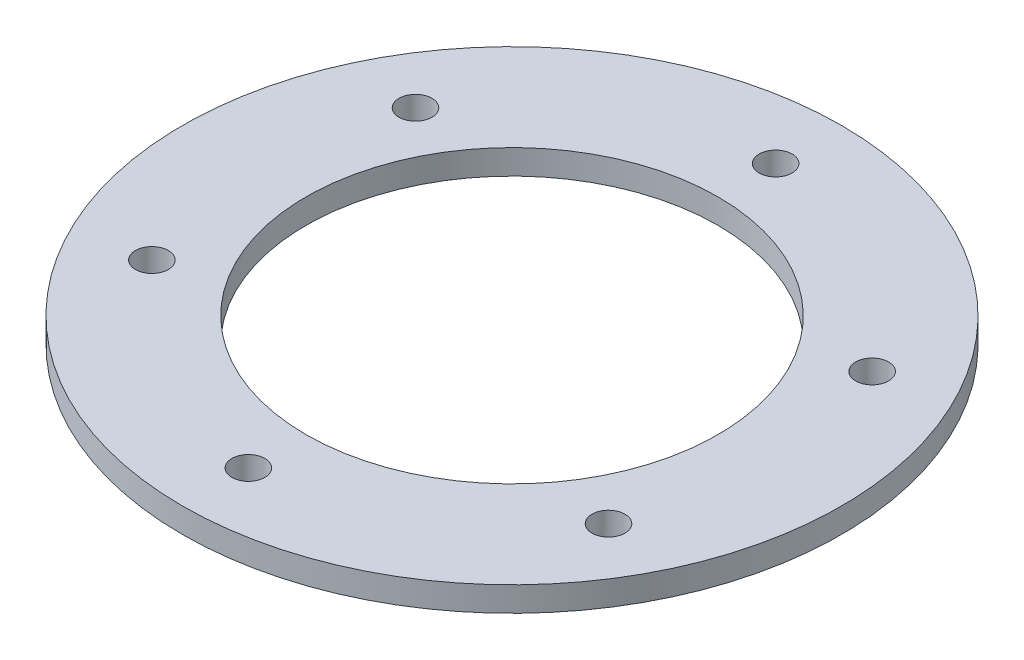
from build123d import *

# Parameters (mm, degrees)
SKETCH_2_R      = 200
SKETCH_2_R_2    = 125
SKETCH_2_R_3    = 10
EXTRUDE_1_DEPTH = 15


with BuildPart() as part:
    # 草圖2 → 填料-伸長1 (new body)
    with BuildSketch(Plane(origin=(0, 0, 0), x_dir=(1, 0, 0), z_dir=(0, 1, 0))):
        with Locations(Location((0, 0, 0), (0, 0, 270))):
            Circle(SKETCH_2_R)
        with Locations(Location((0, 0, 0), (0, 0, 270))):
            Circle(SKETCH_2_R_2, mode=Mode.SUBTRACT)
        with Locations(Location((0, 160, 0), (0, 0, 270))):
            Circle(SKETCH_2_R_3, mode=Mode.SUBTRACT)
        with Locations(Location((138.564064606, 80, 0), (0, 0, 270))):
            Circle(SKETCH_2_R_3, mode=Mode.SUBTRACT)
        with Locations(Location((138.564064606, -80, 0), (0, 0, 270))):
            Circle(SKETCH_2_R_3, mode=Mode.SUBTRACT)
        with Locations(Location((0, -160, 0), (0, 0, 270))):
            Circle(SKETCH_2_R_3, mode=Mode.SUBTRACT)
        with Locations(Location((-138.564064606, -80, 0), (0, 0, 270))):
            Circle(SKETCH_2_R_3, mode=Mode.SUBTRACT)
        with Locations(Location((-138.564064606, 80, 0), (0, 0, 270))):
            Circle(SKETCH_2_R_3, mode=Mode.SUBTRACT)
    extrude(amount=EXTRUDE_1_DEPTH)


solid = part.part
